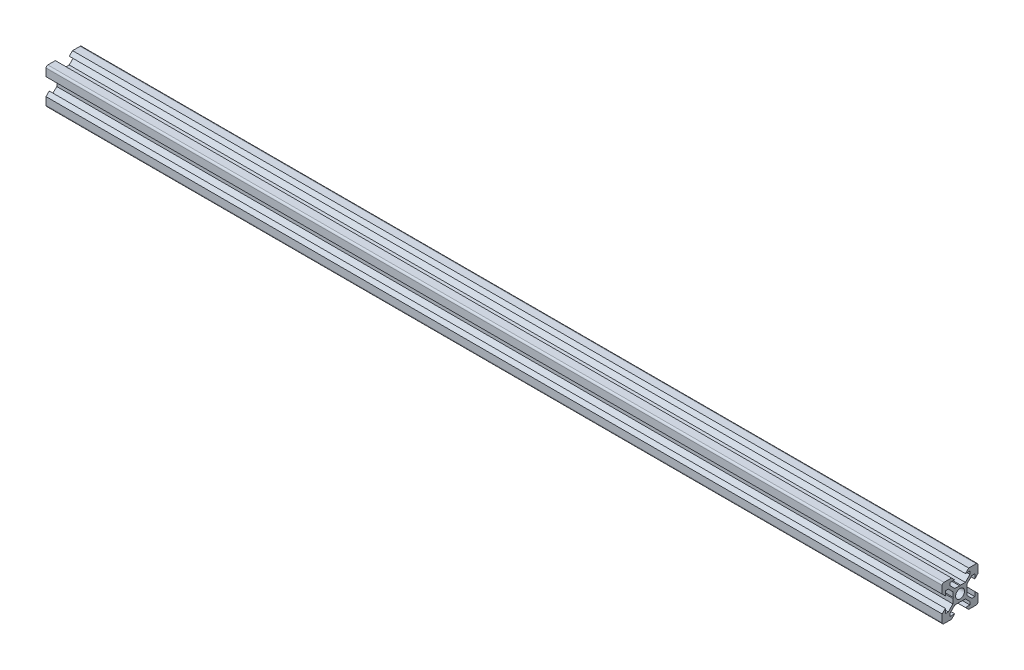
from build123d import *

# Parameters (mm, degrees)
SKETCH11_R                                    = 2.5
C_USERS_USER_GOOGLE_DRIVE_13_INFORMA_ES_DEPTH = 500


with BuildPart() as part:
    # Sketch11 → C_USERS_USER_GOOGLE DRIVE_13. INFORMA_ES (new body)
    with BuildSketch(Plane.YZ):
        with BuildLine():
            Line((-4.8, 10), (-3, 8.2))
            Line((-3, 8.2), (-5.5, 8.2))
            Line((-5.5, 8.2), (-5.5, 6.560660172))
            Line((-5.5, 6.560660172), (-2.939339828, 4))
            Line((-2.939339828, 4), (-0.3, 4))
            Line((-0.3, 4), (0, 3.7))
            Line((0, 3.7), (0.3, 4))
            Line((0.3, 4), (2.939339828, 4))
            Line((2.939339828, 4), (5.5, 6.560660172))
            Line((5.5, 6.560660172), (5.5, 8.2))
            Line((5.5, 8.2), (3, 8.2))
            Line((3, 8.2), (4.8, 10))
            Line((4.8, 10), (9, 10))
            ThreePointArc((9, 10), (9.707106781, 9.707106781), (10, 9))
            Line((10, 9), (10, 4.8))
            Line((10, 4.8), (8.2, 3))
            Line((8.2, 3), (8.2, 5.5))
            Line((8.2, 5.5), (6.560660172, 5.5))
            Line((6.560660172, 5.5), (4, 2.939339828))
            Line((4, 2.939339828), (4, 0.3))
            Line((4, 0.3), (3.7, 0))
            Line((3.7, 0), (4, -0.3))
            Line((4, -0.3), (4, -2.939339828))
            Line((4, -2.939339828), (6.560660172, -5.5))
            Line((6.560660172, -5.5), (8.2, -5.5))
            Line((8.2, -5.5), (8.2, -3))
            Line((8.2, -3), (10, -4.8))
            Line((10, -4.8), (10, -9))
            ThreePointArc((10, -9), (9.707106781, -9.707106781), (9, -10))
            Line((9, -10), (4.8, -10))
            Line((4.8, -10), (3, -8.2))
            Line((3, -8.2), (5.5, -8.2))
            Line((5.5, -8.2), (5.5, -6.560660172))
            Line((5.5, -6.560660172), (2.939339828, -4))
            Line((2.939339828, -4), (0.3, -4))
            Line((0.3, -4), (0, -3.7))
            Line((0, -3.7), (-0.3, -4))
            Line((-0.3, -4), (-2.939339828, -4))
            Line((-2.939339828, -4), (-5.5, -6.560660172))
            Line((-5.5, -6.560660172), (-5.5, -8.2))
            Line((-5.5, -8.2), (-3, -8.2))
            Line((-3, -8.2), (-4.8, -10))
            Line((-4.8, -10), (-9, -10))
            ThreePointArc((-9, -10), (-9.707106781, -9.707106781), (-10, -9))
            Line((-10, -9), (-10, -4.8))
            Line((-10, -4.8), (-8.2, -3))
            Line((-8.2, -3), (-8.2, -5.5))
            Line((-8.2, -5.5), (-6.560660172, -5.5))
            Line((-6.560660172, -5.5), (-4, -2.939339828))
            Line((-4, -2.939339828), (-4, -0.3))
            Line((-4, -0.3), (-3.7, 0))
            Line((-3.7, 0), (-4, 0.3))
            Line((-4, 0.3), (-4, 2.939339828))
            Line((-4, 2.939339828), (-6.560660172, 5.5))
            Line((-6.560660172, 5.5), (-8.2, 5.5))
            Line((-8.2, 5.5), (-8.2, 3))
            Line((-8.2, 3), (-10, 4.8))
            Line((-10, 4.8), (-10, 9))
            ThreePointArc((-10, 9), (-9.707106781, 9.707106781), (-9, 10))
            Line((-9, 10), (-4.8, 10))
        make_face()
        Circle(SKETCH11_R, mode=Mode.SUBTRACT)
    extrude(amount=C_USERS_USER_GOOGLE_DRIVE_13_INFORMA_ES_DEPTH)


solid = part.part
